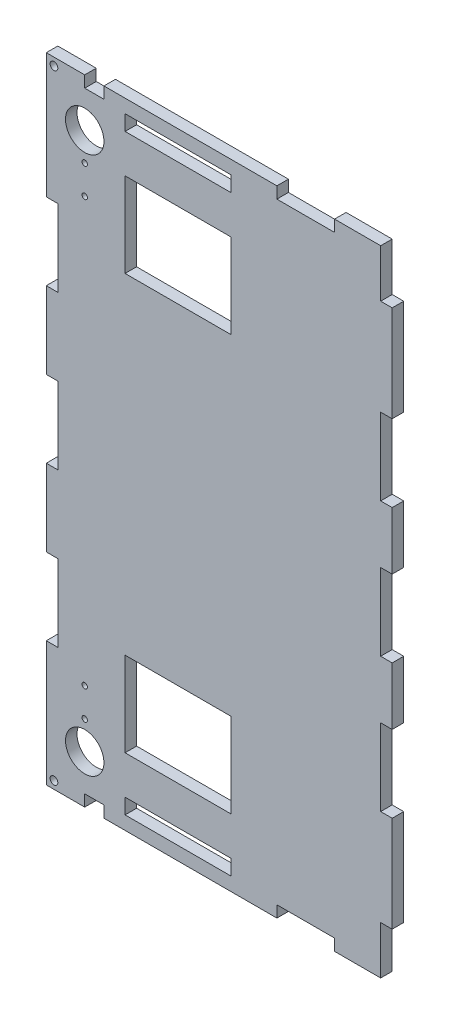
from build123d import *

# Parameters (mm, degrees)
ESQUISSE1_W                       = 180
ESQUISSE1_H                       = 330
BOSS_EXTRU_1_DEPTH                = 6
ESQUISSE2_R                       = 2
ESQUISSE2_R_2                     = 10
ESQUISSE2_R_3                     = 1.4
ESQUISSE2_W                       = 55
ESQUISSE2_H                       = 8
ESQUISSE2_H_2                     = 44
ENL_V_MAT_BLOC_MOTEUR_BILLE_DEPTH = 376.946804748
ESQUISSE3_W                       = 6
ESQUISSE3_H                       = 25
ESQUISSE3_W_2                     = 10
ESQUISSE3_H_2                     = 6
ESQUISSE3_W_3                     = 30
ESQUISSE3_H_3                     = 40
ENL_V_MAT_ENCOCHE_DEPTH           = 376.946804748


with BuildPart() as part:
    # Esquisse1 → Boss.-Extru.1 (new body)
    with BuildSketch(Plane.XY):
        with Locations((-90, 165)):
            Rectangle(ESQUISSE1_W, ESQUISSE1_H)
    extrude(amount=BOSS_EXTRU_1_DEPTH)

    # Esquisse2 → Enlèv. mat bloc moteur + bille (cut, through all)
    with BuildSketch(Plane.XY.offset(6)):
        with Locations((-176, 326)):
            Circle(ESQUISSE2_R)
        with Locations((-160, 305)):
            Circle(ESQUISSE2_R_2)
        with Locations((-160, 290.27)):
            Circle(ESQUISSE2_R_3)
        with Locations((-160, 275.27)):
            Circle(ESQUISSE2_R_3)
        with Locations(Location((-160, 54.73, 0), (0, 0, 180))):
            Circle(ESQUISSE2_R_3)
        with Locations(Location((-160, 39.73, 0), (0, 0, 180))):
            Circle(ESQUISSE2_R_3)
        with Locations(Location((-160, 25, 0), (0, 0, 180))):
            Circle(ESQUISSE2_R_2)
        with Locations(Location((-176, 4, 0), (0, 0, 180))):
            Circle(ESQUISSE2_R)
        with Locations((-111.5, 319)):
            Rectangle(ESQUISSE2_W, ESQUISSE2_H)
        with Locations((-111.5, 273)):
            Rectangle(ESQUISSE2_W, ESQUISSE2_H_2)
        with Locations((-111.5, 11)):
            Rectangle(ESQUISSE2_W, ESQUISSE2_H)
        with Locations((-111.5, 57)):
            Rectangle(ESQUISSE2_W, ESQUISSE2_H_2)
    extrude(amount=-ENL_V_MAT_BLOC_MOTEUR_BILLE_DEPTH, mode=Mode.SUBTRACT)

    # Esquisse3 → Enlèv. mat encoche (cut, through all)
    with BuildSketch(Plane.XY.offset(6)):
        with Locations((-3, 317.5)):
            Rectangle(ESQUISSE3_W, ESQUISSE3_H)
        with Locations((-155, 3)):
            Rectangle(ESQUISSE3_W_2, ESQUISSE3_H_2)
        with Locations((-45, 3)):
            Rectangle(ESQUISSE3_W_3, ESQUISSE3_H_2)
        with Locations((-177, 165)):
            Rectangle(ESQUISSE3_W, ESQUISSE3_H_3)
        with Locations((-177, 85)):
            Rectangle(ESQUISSE3_W, ESQUISSE3_H_3)
        with Locations((-155, 327)):
            Rectangle(ESQUISSE3_W_2, ESQUISSE3_H_2)
        with Locations((-45, 327)):
            Rectangle(ESQUISSE3_W_3, ESQUISSE3_H_2)
        with Locations((-177, 245)):
            Rectangle(ESQUISSE3_W, ESQUISSE3_H_3)
        with Locations((-3, 235)):
            Rectangle(ESQUISSE3_W, ESQUISSE3_H_3)
        with Locations((-3, 165)):
            Rectangle(ESQUISSE3_W, ESQUISSE3_H_3)
        with Locations((-3, 95)):
            Rectangle(ESQUISSE3_W, ESQUISSE3_H_3)
        with Locations((-3, 12.5)):
            Rectangle(ESQUISSE3_W, ESQUISSE3_H)
    extrude(amount=-ENL_V_MAT_ENCOCHE_DEPTH, mode=Mode.SUBTRACT)


solid = part.part
